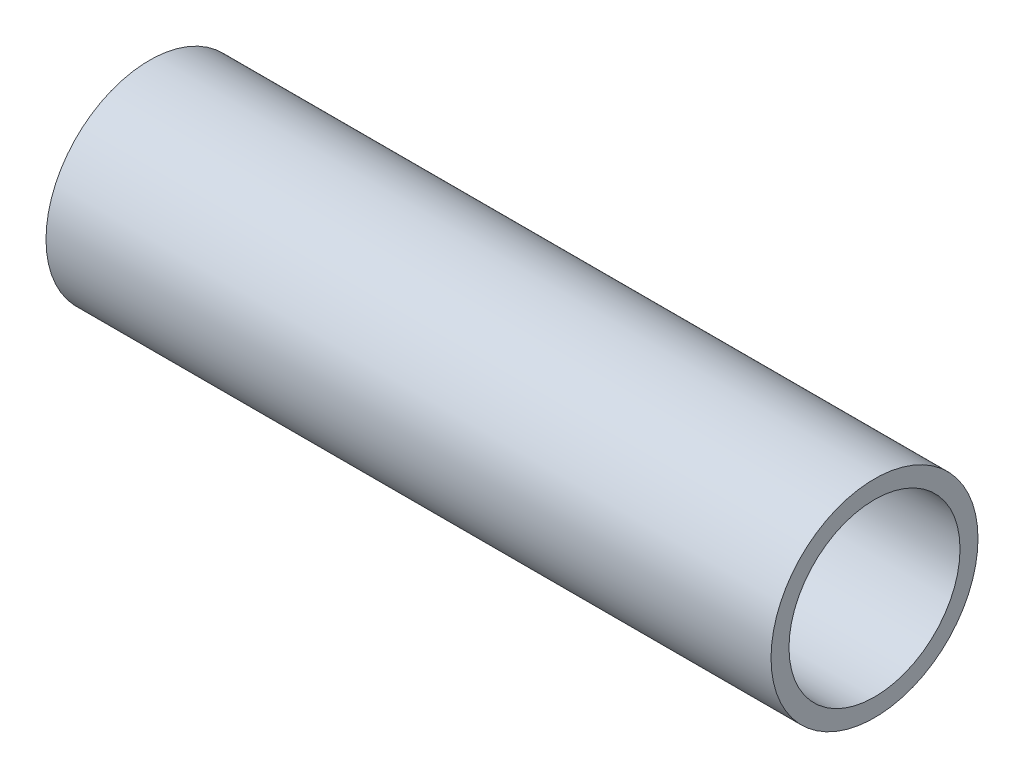
from build123d import *

# Parameters (mm, degrees)
SKETCH1_R           = 16.7
SKETCH1_R_2         = 13.8
BOSS_EXTRUDE1_DEPTH = 117


with BuildPart() as part:
    # Sketch1 → Boss-Extrude1 (new body)
    with BuildSketch(Plane(origin=(0, 0, 0), x_dir=(0, 0, -1), z_dir=(1, 0, 0))):
        Circle(SKETCH1_R)
        Circle(SKETCH1_R_2, mode=Mode.SUBTRACT)
    extrude(amount=BOSS_EXTRUDE1_DEPTH)


solid = part.part
